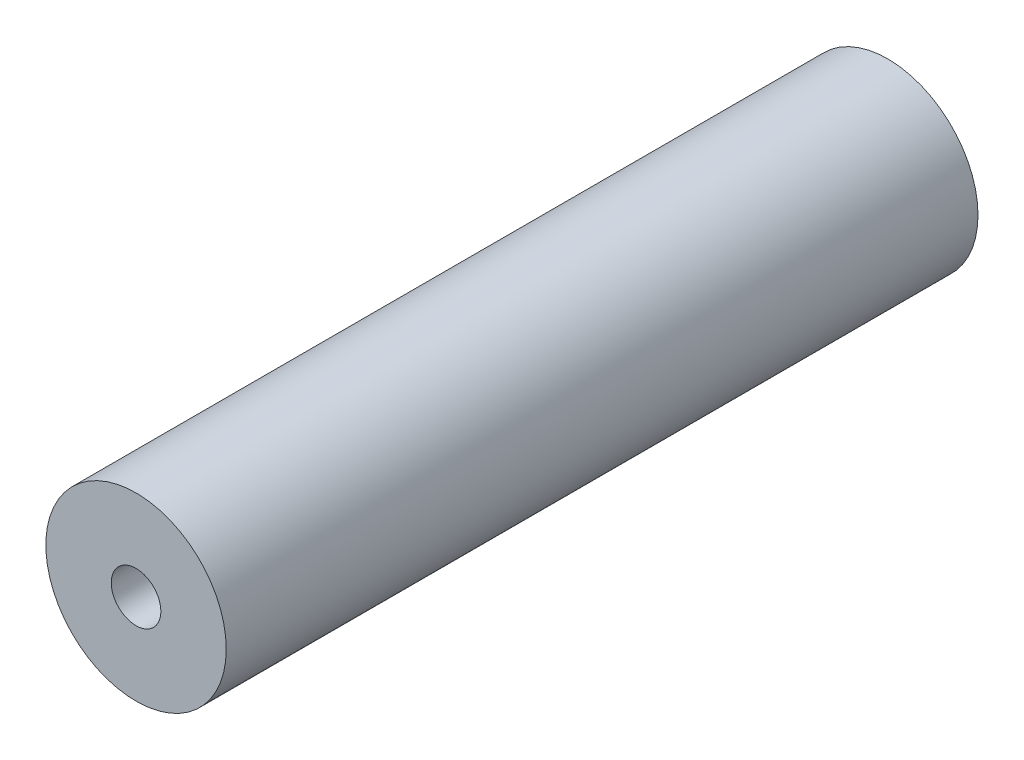
from build123d import *

# Parameters (mm, degrees)
SKETCH_1_R          = 6
EXTRUDE_1_DEPTH     = 50
SKETCH_2_R          = 1.65
CUT_EXTRUDE_1_DEPTH = 15
CUT_EXTRUDE_START   = -15
SKETCH_5_R          = 1.65
CUT_EXTRUDE_2_DEPTH = 15


with BuildPart() as part:
    # Эскиз1 → Бобышка-Вытянуть1 (new body)
    with BuildSketch(Plane.XY):
        Circle(SKETCH_1_R)
    extrude(amount=EXTRUDE_1_DEPTH)

    # Эскиз2 → Вырез-Вытянуть1 (cut)
    with BuildSketch(Plane.XY.offset(50)):
        Circle(SKETCH_2_R)
    extrude(amount=-CUT_EXTRUDE_1_DEPTH, mode=Mode.SUBTRACT)

    # Эскиз5 → Вырез-Вытянуть2 (cut)
    with BuildSketch(Plane(origin=(0, 0, 0), x_dir=(-1, 0, 0), z_dir=(0, 0, -1)).offset(CUT_EXTRUDE_START)):
        with Locations(Location((0, 0, 0), (0, 0, 180))):
            Circle(SKETCH_5_R)
    extrude(amount=CUT_EXTRUDE_2_DEPTH, mode=Mode.SUBTRACT)


solid = part.part
